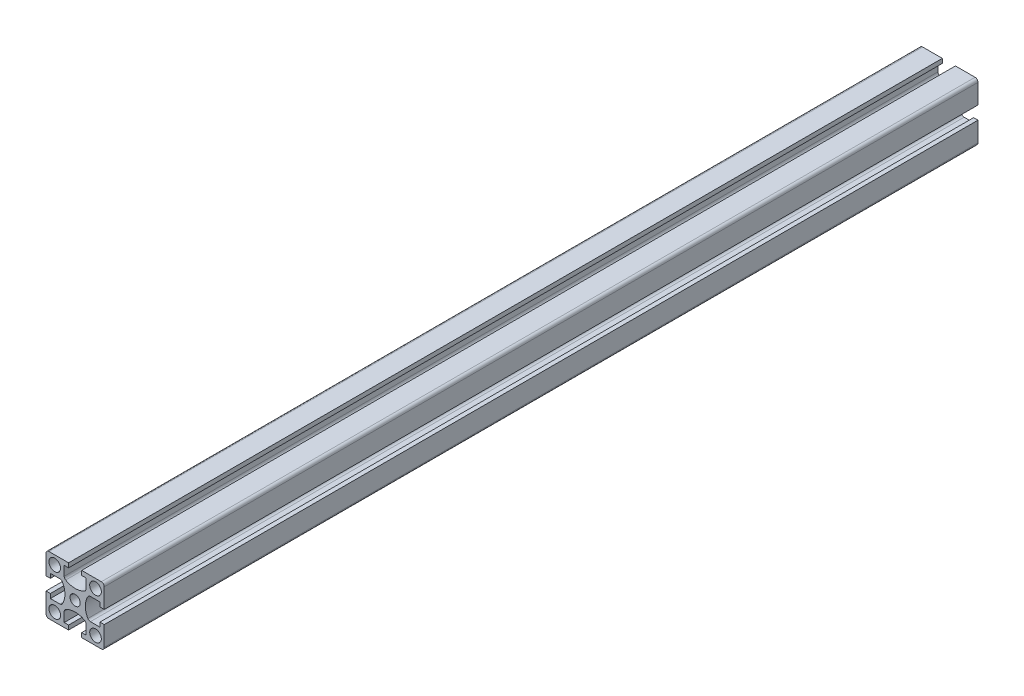
from build123d import *

# Parameters (mm, degrees)
SKETCH1_R           = 2.5
SKETCH1_R_2         = 2.1875
BOSS_EXTRUDE1_DEPTH = 375


with BuildPart() as part:
    # Sketch1 → Boss-Extrude1 (new body)
    with BuildSketch(Plane.XY):
        with BuildLine():
            Line((-12.5, 11.25), (-12.5, 2.8125))
            Line((-12.5, 2.8125), (-10.625, 2.8125))
            Line((-10.625, 2.8125), (-10.625, 4.6875))
            Line((-10.625, 4.6875), (-6.546075349, 4.6875))
            ThreePointArc((-6.546075349, 4.6875), (-5.921075349, 4.520031755), (-5.463543594, 4.0625))
            ThreePointArc((-5.463543594, 4.0625), (-4.375, 0), (-5.463543594, -4.0625))
            ThreePointArc((-5.463543594, -4.0625), (-5.921075349, -4.520031755), (-6.546075349, -4.6875))
            Line((-6.546075349, -4.6875), (-10.625, -4.6875))
            Line((-10.625, -4.6875), (-10.625, -2.8125))
            Line((-10.625, -2.8125), (-12.5, -2.8125))
            Line((-12.5, -2.8125), (-12.5, -11.25))
            ThreePointArc((-12.5, -11.25), (-12.133883476, -12.133883476), (-11.25, -12.5))
            Line((-11.25, -12.5), (-2.8125, -12.5))
            Line((-2.8125, -12.5), (-2.8125, -10.625))
            Line((-2.8125, -10.625), (-4.6875, -10.625))
            Line((-4.6875, -10.625), (-4.6875, -6.546075349))
            ThreePointArc((-4.6875, -6.546075349), (-4.520031755, -5.921075349), (-4.0625, -5.463543594))
            ThreePointArc((-4.0625, -5.463543594), (0, -4.375), (4.0625, -5.463543594))
            ThreePointArc((4.0625, -5.463543594), (4.520031755, -5.921075349), (4.6875, -6.546075349))
            Line((4.6875, -6.546075349), (4.6875, -10.625))
            Line((4.6875, -10.625), (2.8125, -10.625))
            Line((2.8125, -10.625), (2.8125, -12.5))
            Line((2.8125, -12.5), (11.25, -12.5))
            ThreePointArc((11.25, -12.5), (12.133883476, -12.133883476), (12.5, -11.25))
            Line((12.5, -11.25), (12.5, -2.8125))
            Line((12.5, -2.8125), (10.625, -2.8125))
            Line((10.625, -2.8125), (10.625, -4.6875))
            Line((10.625, -4.6875), (6.546075349, -4.6875))
            ThreePointArc((6.546075349, -4.6875), (5.921075349, -4.520031755), (5.463543594, -4.0625))
            ThreePointArc((5.463543594, -4.0625), (4.375, 0), (5.463543594, 4.0625))
            ThreePointArc((5.463543594, 4.0625), (5.921075349, 4.520031755), (6.546075349, 4.6875))
            Line((6.546075349, 4.6875), (10.625, 4.6875))
            Line((10.625, 4.6875), (10.625, 2.8125))
            Line((10.625, 2.8125), (12.5, 2.8125))
            Line((12.5, 2.8125), (12.5, 11.25))
            ThreePointArc((12.5, 11.25), (12.133883476, 12.133883476), (11.25, 12.5))
            Line((11.25, 12.5), (2.8125, 12.5))
            Line((2.8125, 12.5), (2.8125, 10.625))
            Line((2.8125, 10.625), (4.6875, 10.625))
            Line((4.6875, 10.625), (4.6875, 6.546075349))
            ThreePointArc((4.6875, 6.546075349), (4.520031755, 5.921075349), (4.0625, 5.463543594))
            ThreePointArc((4.0625, 5.463543594), (0, 4.375), (-4.0625, 5.463543594))
            ThreePointArc((-4.0625, 5.463543594), (-4.520031755, 5.921075349), (-4.6875, 6.546075349))
            Line((-4.6875, 6.546075349), (-4.6875, 10.625))
            Line((-4.6875, 10.625), (-2.8125, 10.625))
            Line((-2.8125, 10.625), (-2.8125, 12.5))
            Line((-2.8125, 12.5), (-11.25, 12.5))
            ThreePointArc((-11.25, 12.5), (-12.133883476, 12.133883476), (-12.5, 11.25))
        make_face()
        with Locations((-8.75, -8.75)):
            Circle(SKETCH1_R, mode=Mode.SUBTRACT)
        with Locations((8.75, -8.75)):
            Circle(SKETCH1_R, mode=Mode.SUBTRACT)
        with Locations((8.75, 8.75)):
            Circle(SKETCH1_R, mode=Mode.SUBTRACT)
        Circle(SKETCH1_R_2, mode=Mode.SUBTRACT)
        with Locations((-8.75, 8.75)):
            Circle(SKETCH1_R, mode=Mode.SUBTRACT)
    extrude(amount=BOSS_EXTRUDE1_DEPTH)


solid = part.part
